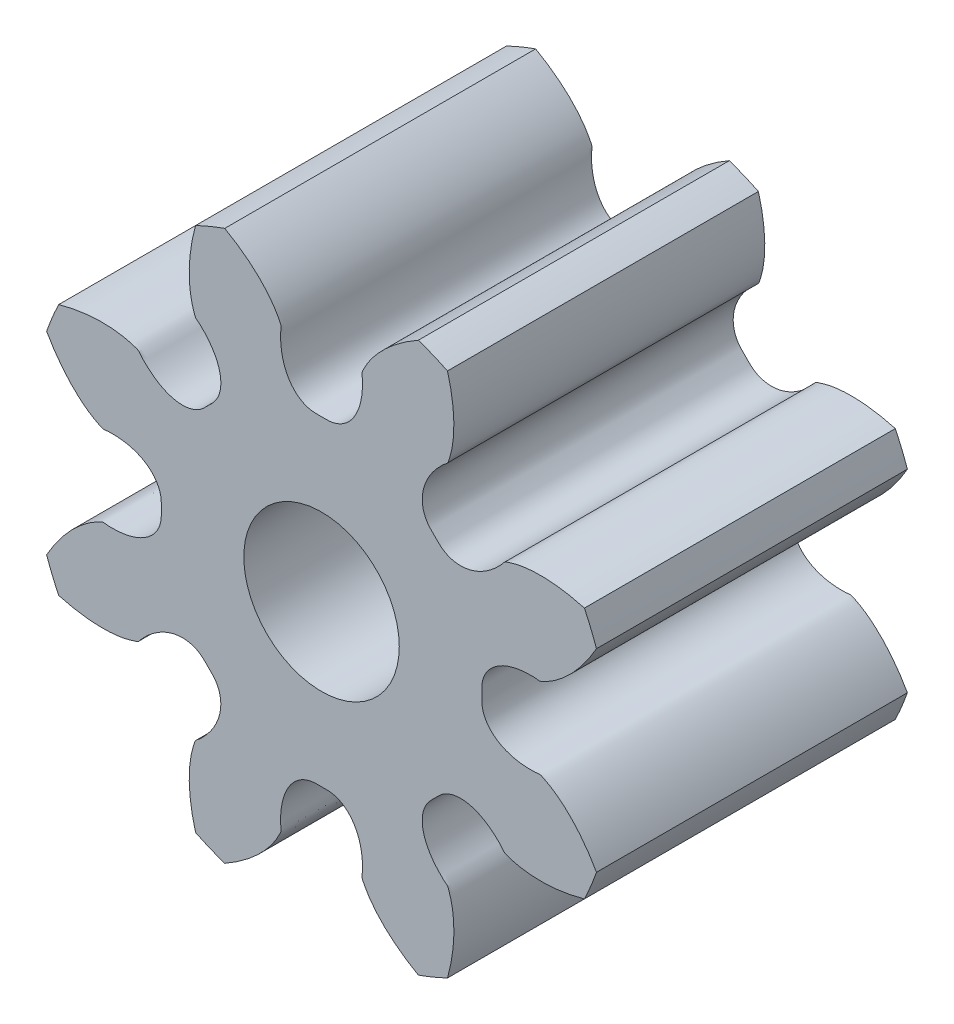
from build123d import *

# Parameters (mm, degrees)
SKETCHREVOLVESPUR01_W                   = 1
SKETCHREVOLVESPUR01_H                   = 0.9375
TOOTHEXTRUDECUTSPUR01_REACH             = 3.523
TOOTHEXTRUDECUTSPUR01_DIRECTION_2_DEPTH = 0.25
PATTERNSPUR01_COUNT                     = 8
CORTAR_EXTRUIR2_REACH                   = 3.601
CROQUIS5_R                              = 0.25


with BuildPart() as part:
    # SketchRevolveSpur01 → Spur01 (revolve)
    with BuildSketch(Plane(origin=(0, 0, 0), x_dir=(0, 0, -1), z_dir=(1, 0, 0))):
        with Locations((0.25, 0.46875)):
            Rectangle(SKETCHREVOLVESPUR01_W, SKETCHREVOLVESPUR01_H)
    revolve(axis=Axis((0, 0, 0), (0, 0, -1)))

    # SketchToothSpur01 → ToothExtrudeCutSpur01 (cut, up to next)
    with BuildSketch(Plane.XY, mode=Mode.PRIVATE) as toothextrudecutspur01_sk1:
        with BuildLine():
            ThreePointArc((0.890309199, 0.322369036), (0.946875, 0), (0.890309199, -0.322369036))
            add(Edge.make_bspline(
                [(0.890309199, -0.322369036), (0.877903339, -0.299242053), (0.859959599, -0.270217029), (0.834969931, -0.237237611), (0.820916314, -0.220322543), (0.807073697, -0.205103545), (0.793564035, -0.191525539), (0.780504605, -0.179526409), (0.768007855, -0.169035119), (0.756180166, -0.159979833), (0.7451242, -0.152262782), (0.73492979, -0.145842384), (0.725701189, -0.140475942), (0.715286218, -0.13546339), (0.702821246, -0.127890706), (0.688736461, -0.131763586), (0.677200247, -0.131673571), (0.668427432, -0.131729473), (0.659832141, -0.131406931), (0.651399963, -0.130840755), (0.643138731, -0.129998762), (0.635050187, -0.128891624), (0.627137423, -0.127518019), (0.619403004, -0.125878795), (0.611849568, -0.123973123), (0.6044798, -0.121799328), (0.597296628, -0.119354494), (0.590303417, -0.116634383), (0.583504248, -0.113633281), (0.576904257, -0.110343885), (0.570510084, -0.106757229), (0.564330416, -0.102862692), (0.558376651, -0.098648121), (0.552663676, -0.094100136), (0.547210734, -0.089204692), (0.542042338, -0.08394797), (0.537189134, -0.0783177), (0.532688537, -0.072304957), (0.528585012, -0.065906458), (0.524929483, -0.059127269), (0.521778464, -0.051983651), (0.51918946, -0.044505795), (0.517224961, -0.036739308), (0.515918287, -0.028747039), (0.515448385, -0.021635558), (0.515321452, -0.012042707), (0.515853444, 0), (0.515321452, 0.012042707), (0.515448385, 0.021635558), (0.515918287, 0.028747039), (0.517224961, 0.036739308), (0.51918946, 0.044505795), (0.521778464, 0.051983651), (0.524929483, 0.059127269), (0.528585012, 0.065906458), (0.532688537, 0.072304957), (0.537189134, 0.0783177), (0.542042338, 0.08394797), (0.547210734, 0.089204692), (0.552663676, 0.094100136), (0.558376651, 0.098648121), (0.564330416, 0.102862692), (0.570510084, 0.106757229), (0.576904257, 0.110343885), (0.583504248, 0.113633281), (0.590303417, 0.116634383), (0.597296628, 0.119354494), (0.6044798, 0.121799328), (0.611849568, 0.123973123), (0.619403004, 0.125878795), (0.627137423, 0.127518019), (0.635050187, 0.128891624), (0.643138731, 0.129998762), (0.651399963, 0.130840755), (0.659832141, 0.131406931), (0.668427432, 0.131729473), (0.677200247, 0.131673571), (0.688736461, 0.131763586), (0.702821246, 0.127890706), (0.715286218, 0.13546339), (0.725701189, 0.140475942), (0.73492979, 0.145842384), (0.7451242, 0.152262782), (0.756180166, 0.159979833), (0.768007855, 0.169035119), (0.780504605, 0.179526409), (0.793564035, 0.191525539), (0.807073697, 0.205103545), (0.820916314, 0.220322543), (0.834969931, 0.237237611), (0.859959599, 0.270217029), (0.877903339, 0.299242053), (0.890309199, 0.322369036)],
                knots=[0, 0, 0, 0, 0.073215091, 0.094985485, 0.115436462, 0.13456802, 0.152380161, 0.168872885, 0.18404619, 0.197900078, 0.210434548, 0.2216496, 0.231545235, 0.240121452, 0.254210701, 0.270122213, 0.278421846, 0.286569565, 0.29456997, 0.302428107, 0.310149525, 0.317740329, 0.325207234, 0.332557632, 0.339799658, 0.346942256, 0.353995249, 0.360969402, 0.367876475, 0.374729261, 0.381541598, 0.388328329, 0.395105215, 0.40188875, 0.408695881, 0.415543575, 0.422448236, 0.429424941, 0.436486513, 0.443642464, 0.450897926, 0.458252678, 0.465700501, 0.473229037, 0.480820311, 0.485565802, 0.5, 0.514434198, 0.519179689, 0.526770963, 0.534299499, 0.541747322, 0.549102074, 0.556357536, 0.563513487, 0.570575059, 0.577551764, 0.584456425, 0.591304119, 0.59811125, 0.604894785, 0.611671671, 0.618458402, 0.625270739, 0.632123525, 0.639030598, 0.646004751, 0.653057744, 0.660200342, 0.667442368, 0.674792766, 0.682259671, 0.689850475, 0.697571893, 0.70543003, 0.713430435, 0.721578154, 0.729877787, 0.745789299, 0.759878548, 0.768454765, 0.7783504, 0.789565452, 0.802099922, 0.81595381, 0.831127115, 0.847619839, 0.86543198, 0.884563538, 0.905014515, 0.926784909, 1, 1, 1, 1], degree=3))
        make_face()
    toothextrudecutspur01_tool1 = extrude(toothextrudecutspur01_sk1.sketch, amount=-TOOTHEXTRUDECUTSPUR01_REACH, mode=Mode.PRIVATE) & part.part
    toothextrudecutspur01 = toothextrudecutspur01_tool1.solids().sort_by_distance((0.771962, 0, 0))[0]
    add(toothextrudecutspur01, mode=Mode.SUBTRACT)

    # SketchToothSpur01 → ToothExtrudeCutSpur01 direction 2 (cut)
    with BuildSketch(Plane.XY):
        with BuildLine():
            ThreePointArc((0.890309199, 0.322369036), (0.946875, 0), (0.890309199, -0.322369036))
            add(Edge.make_bspline(
                [(0.890309199, -0.322369036), (0.877903339, -0.299242053), (0.859959599, -0.270217029), (0.834969931, -0.237237611), (0.820916314, -0.220322543), (0.807073697, -0.205103545), (0.793564035, -0.191525539), (0.780504605, -0.179526409), (0.768007855, -0.169035119), (0.756180166, -0.159979833), (0.7451242, -0.152262782), (0.73492979, -0.145842384), (0.725701189, -0.140475942), (0.715286218, -0.13546339), (0.702821246, -0.127890706), (0.688736461, -0.131763586), (0.677200247, -0.131673571), (0.668427432, -0.131729473), (0.659832141, -0.131406931), (0.651399963, -0.130840755), (0.643138731, -0.129998762), (0.635050187, -0.128891624), (0.627137423, -0.127518019), (0.619403004, -0.125878795), (0.611849568, -0.123973123), (0.6044798, -0.121799328), (0.597296628, -0.119354494), (0.590303417, -0.116634383), (0.583504248, -0.113633281), (0.576904257, -0.110343885), (0.570510084, -0.106757229), (0.564330416, -0.102862692), (0.558376651, -0.098648121), (0.552663676, -0.094100136), (0.547210734, -0.089204692), (0.542042338, -0.08394797), (0.537189134, -0.0783177), (0.532688537, -0.072304957), (0.528585012, -0.065906458), (0.524929483, -0.059127269), (0.521778464, -0.051983651), (0.51918946, -0.044505795), (0.517224961, -0.036739308), (0.515918287, -0.028747039), (0.515448385, -0.021635558), (0.515321452, -0.012042707), (0.515853444, 0), (0.515321452, 0.012042707), (0.515448385, 0.021635558), (0.515918287, 0.028747039), (0.517224961, 0.036739308), (0.51918946, 0.044505795), (0.521778464, 0.051983651), (0.524929483, 0.059127269), (0.528585012, 0.065906458), (0.532688537, 0.072304957), (0.537189134, 0.0783177), (0.542042338, 0.08394797), (0.547210734, 0.089204692), (0.552663676, 0.094100136), (0.558376651, 0.098648121), (0.564330416, 0.102862692), (0.570510084, 0.106757229), (0.576904257, 0.110343885), (0.583504248, 0.113633281), (0.590303417, 0.116634383), (0.597296628, 0.119354494), (0.6044798, 0.121799328), (0.611849568, 0.123973123), (0.619403004, 0.125878795), (0.627137423, 0.127518019), (0.635050187, 0.128891624), (0.643138731, 0.129998762), (0.651399963, 0.130840755), (0.659832141, 0.131406931), (0.668427432, 0.131729473), (0.677200247, 0.131673571), (0.688736461, 0.131763586), (0.702821246, 0.127890706), (0.715286218, 0.13546339), (0.725701189, 0.140475942), (0.73492979, 0.145842384), (0.7451242, 0.152262782), (0.756180166, 0.159979833), (0.768007855, 0.169035119), (0.780504605, 0.179526409), (0.793564035, 0.191525539), (0.807073697, 0.205103545), (0.820916314, 0.220322543), (0.834969931, 0.237237611), (0.859959599, 0.270217029), (0.877903339, 0.299242053), (0.890309199, 0.322369036)],
                knots=[0, 0, 0, 0, 0.073215091, 0.094985485, 0.115436462, 0.13456802, 0.152380161, 0.168872885, 0.18404619, 0.197900078, 0.210434548, 0.2216496, 0.231545235, 0.240121452, 0.254210701, 0.270122213, 0.278421846, 0.286569565, 0.29456997, 0.302428107, 0.310149525, 0.317740329, 0.325207234, 0.332557632, 0.339799658, 0.346942256, 0.353995249, 0.360969402, 0.367876475, 0.374729261, 0.381541598, 0.388328329, 0.395105215, 0.40188875, 0.408695881, 0.415543575, 0.422448236, 0.429424941, 0.436486513, 0.443642464, 0.450897926, 0.458252678, 0.465700501, 0.473229037, 0.480820311, 0.485565802, 0.5, 0.514434198, 0.519179689, 0.526770963, 0.534299499, 0.541747322, 0.549102074, 0.556357536, 0.563513487, 0.570575059, 0.577551764, 0.584456425, 0.591304119, 0.59811125, 0.604894785, 0.611671671, 0.618458402, 0.625270739, 0.632123525, 0.639030598, 0.646004751, 0.653057744, 0.660200342, 0.667442368, 0.674792766, 0.682259671, 0.689850475, 0.697571893, 0.70543003, 0.713430435, 0.721578154, 0.729877787, 0.745789299, 0.759878548, 0.768454765, 0.7783504, 0.789565452, 0.802099922, 0.81595381, 0.831127115, 0.847619839, 0.86543198, 0.884563538, 0.905014515, 0.926784909, 1, 1, 1, 1], degree=3))
        make_face()
    toothextrudecutspur01_direction_2 = extrude(amount=TOOTHEXTRUDECUTSPUR01_DIRECTION_2_DEPTH, mode=Mode.SUBTRACT)

    # PatternSpur01: ToothExtrudeCutSpur01, ToothExtrudeCutSpur01 direction 2 ×8 about axis
    patternspur01_axis = Axis((0, 0, 55), (0, 0, -1))
    add([toothextrudecutspur01.rotate(patternspur01_axis, i * 360 / PATTERNSPUR01_COUNT) for i in range(1, PATTERNSPUR01_COUNT)], mode=Mode.SUBTRACT)
    add([toothextrudecutspur01_direction_2.rotate(patternspur01_axis, i * 360 / PATTERNSPUR01_COUNT) for i in range(1, PATTERNSPUR01_COUNT)], mode=Mode.SUBTRACT)

    # Croquis5 → Cortar-Extruir2 (cut, up to next)
    with BuildSketch(Plane.XY.offset(0.25), mode=Mode.PRIVATE) as cortar_extruir2_sk1:
        Circle(CROQUIS5_R)
    cortar_extruir2_tool1 = extrude(cortar_extruir2_sk1.sketch, amount=-CORTAR_EXTRUIR2_REACH, mode=Mode.PRIVATE) & part.part
    add(cortar_extruir2_tool1.solids().sort_by_distance((0, 0, 0.25))[0], mode=Mode.SUBTRACT)


solid = part.part
